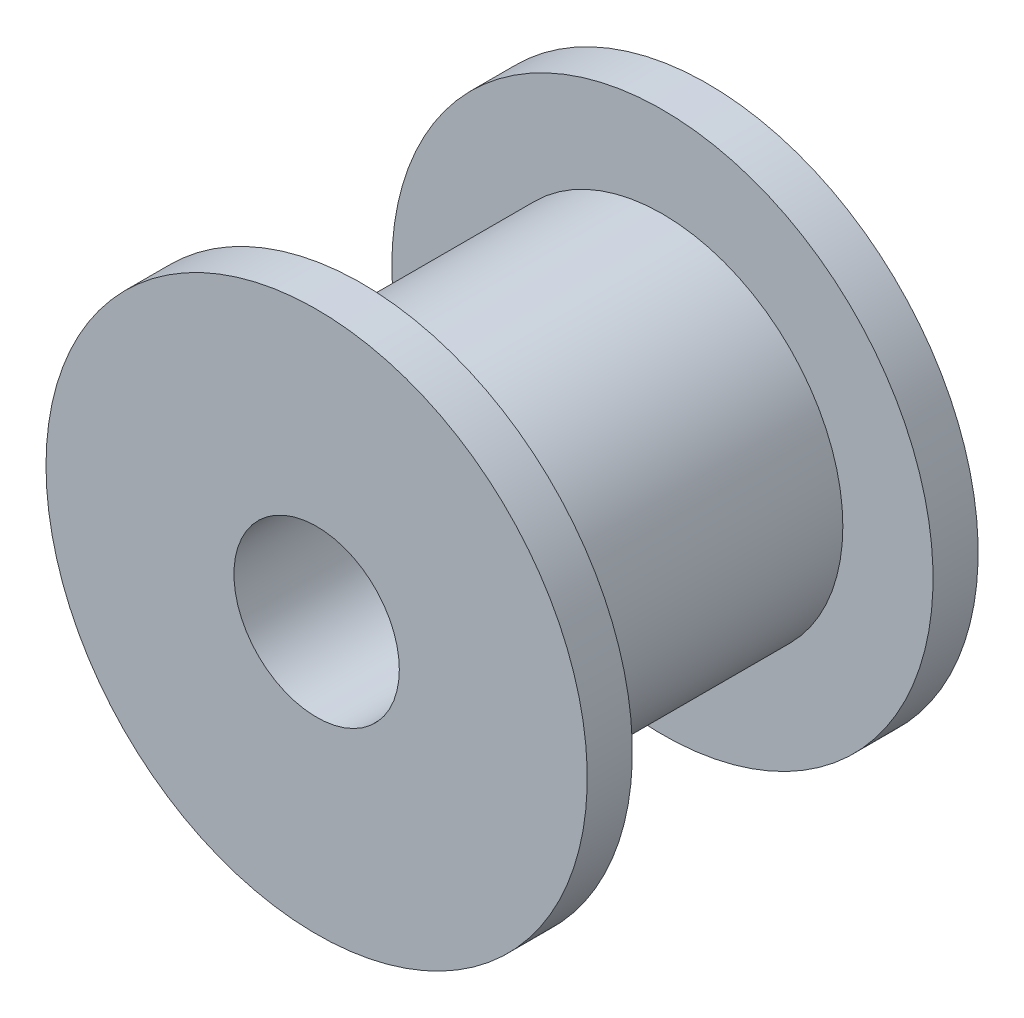
from build123d import *

# Parameters (mm, degrees)
SKETCH1_R           = 9
BOSS_EXTRUDE1_DEPTH = 6.5
SKETCH2_R           = 9
SKETCH2_R_2         = 6
CUT_EXTRUDE2_DEPTH  = 5
SKETCH3_R           = 2.75
CUT_EXTRUDE3_DEPTH  = 19.193405399


with BuildPart() as part:
    # Sketch1 → Boss-Extrude1 (new, symmetric)
    with BuildSketch(Plane.XY):
        with Locations(Location((0, 0, 0), (0, 0, 180))):
            Circle(SKETCH1_R)
    extrude(amount=BOSS_EXTRUDE1_DEPTH, both=True)

    # Sketch2 → Cut-Extrude2 (cut, symmetric)
    with BuildSketch(Plane.XY):
        with Locations(Location((0, 0, 0), (0, 0, 180))):
            Circle(SKETCH2_R)
        Circle(SKETCH2_R_2, mode=Mode.SUBTRACT)
    extrude(amount=CUT_EXTRUDE2_DEPTH, both=True, mode=Mode.SUBTRACT)

    # Sketch3 → Cut-Extrude3 (cut, through all)
    with BuildSketch(Plane.XY.offset(6.5)):
        Circle(SKETCH3_R)
    extrude(amount=-CUT_EXTRUDE3_DEPTH, mode=Mode.SUBTRACT)


solid = part.part
